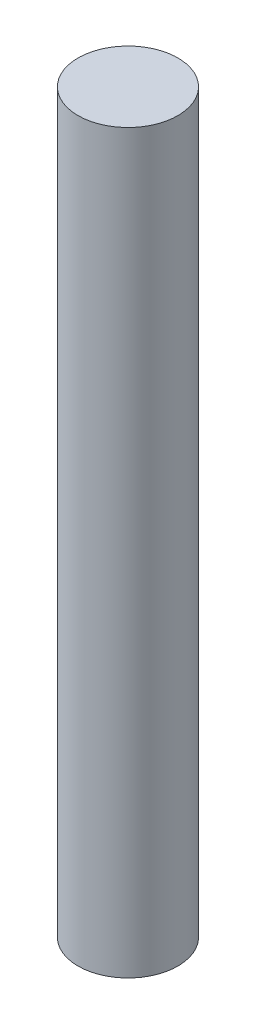
from build123d import *

# Parameters (mm, degrees)
SKETCH1_R           = 4
BOSS_EXTRUDE1_DEPTH = 59


with BuildPart() as part:
    # Sketch1 → Boss-Extrude1 (new body)
    with BuildSketch(Plane(origin=(0, 0, 0), x_dir=(1, 0, 0), z_dir=(0, 1, 0))):
        with Locations(Location((0, 0, 0), (0, 0, 270))):
            Circle(SKETCH1_R)
    extrude(amount=BOSS_EXTRUDE1_DEPTH)


solid = part.part
